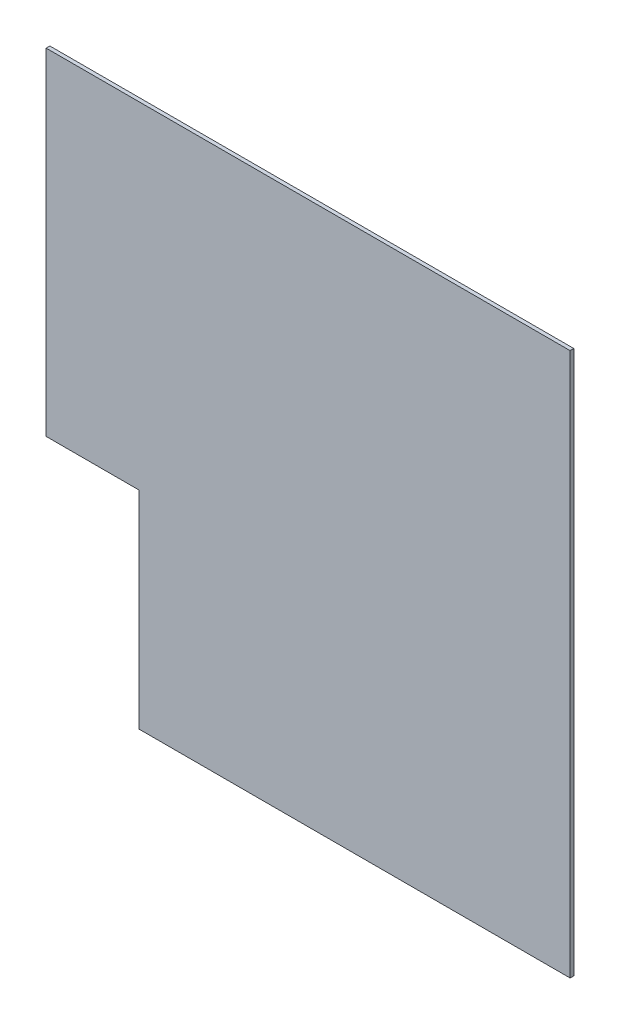
from build123d import *

# Parameters (mm, degrees)
BOSS_EXTRU_1_DEPTH = 6.5


with BuildPart() as part:
    # Esquisse1 → Boss.-Extru.1 (new body)
    with BuildSketch(Plane.XY):
        Polygon((-405.459212908, -167.490990979), (-243.459212908, -167.490990979), (-243.459212908, -529.490990979), (510.540787092, -529.490990979), (510.540787092, 420.509009021), (-405.459212908, 420.509009021), align=None)
    extrude(amount=BOSS_EXTRU_1_DEPTH)


solid = part.part
